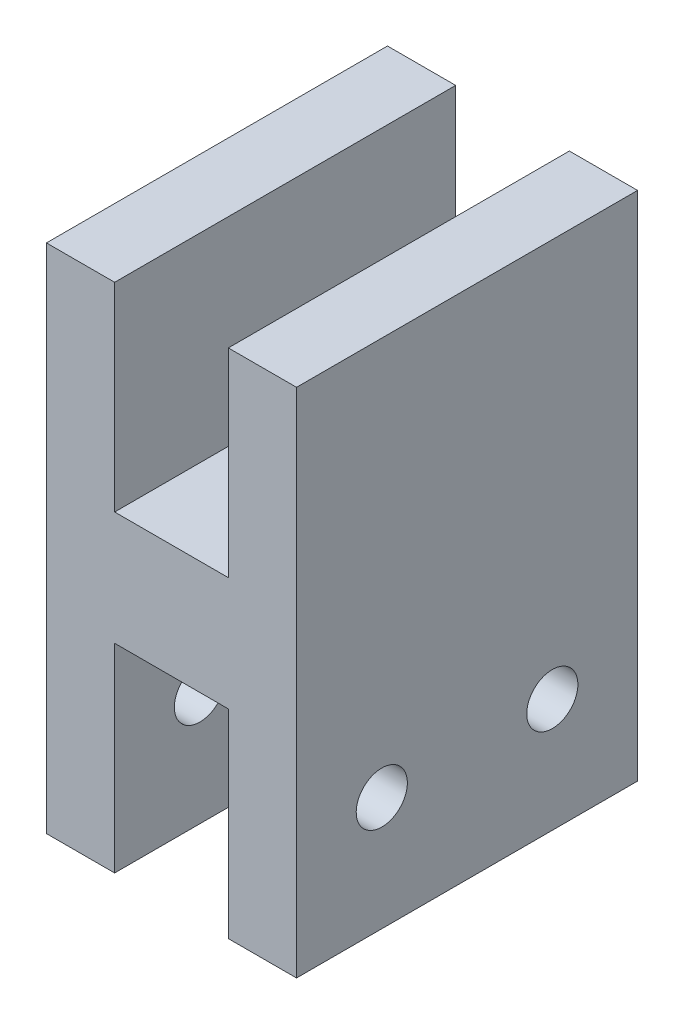
from build123d import *

# Parameters (mm, degrees)
ESTRUSIONE_ESTRUSIONE1_DEPTH = 30
FORO_PER_VITE_M4_1_D         = 4.5
FORO_PER_VITE_M4_1_DEPTH     = 30
FORO_PER_VITE_M4_1_TIP       = 1.351936393


with BuildPart() as part:
    # Schizzo1 → Estrusione-Estrusione1 (new body)
    with BuildSketch(Plane.XY):
        Polygon((11, -27.5), (11, 17.5), (5, 17.5), (5, 0), (-5, 0), (-5, 17.5), (-11, 17.5), (-11, -27.5), (-5, -27.5), (-5, -10), (5, -10), (5, -27.5), align=None)
    extrude(amount=ESTRUSIONE_ESTRUSIONE1_DEPTH)

    # Foro per Vite M4-1
    with Locations(Plane(origin=(-11, -17.5, 22.5), x_dir=(0, -1, 0), z_dir=(-1, 0, 0))):
        with Locations((0, 0), (0, -15)):
            Hole(FORO_PER_VITE_M4_1_D / 2, depth=FORO_PER_VITE_M4_1_DEPTH)
            with Locations((0, 0, -(FORO_PER_VITE_M4_1_DEPTH + FORO_PER_VITE_M4_1_TIP / 2))):  # 118° drill point
                Cone(0, FORO_PER_VITE_M4_1_D / 2, FORO_PER_VITE_M4_1_TIP, mode=Mode.SUBTRACT)


solid = part.part
